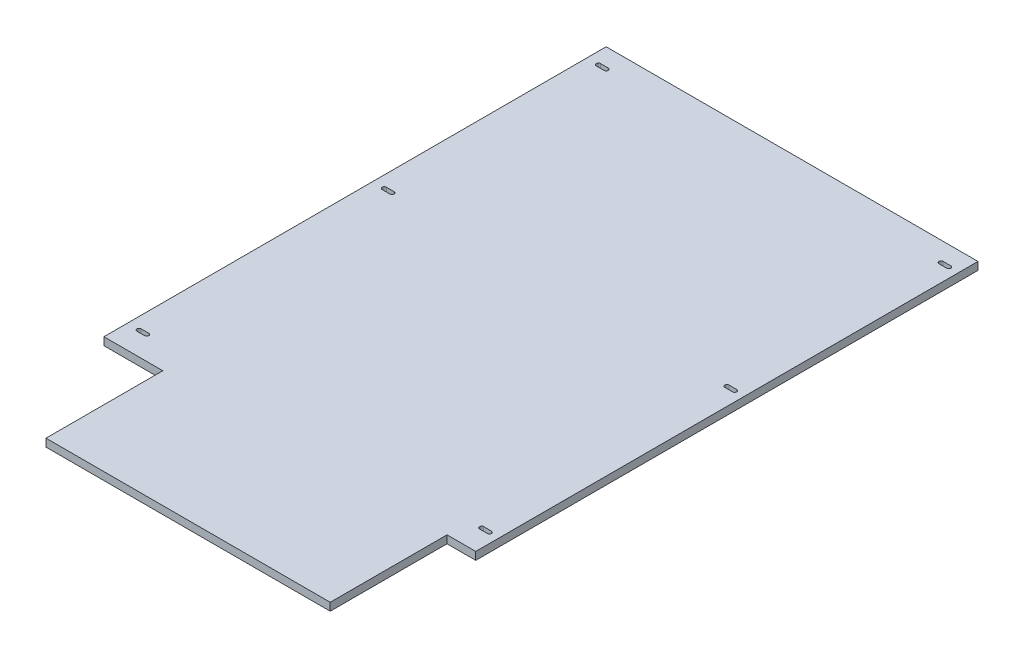
from build123d import *

# Parameters (mm, degrees)
BOSS_EXTRUDE1_DEPTH = 12.7


with BuildPart() as part:
    # Sketch1 → Boss-Extrude1 (new body)
    with BuildSketch(Plane(origin=(0, 0, 0), x_dir=(1, 0, 0), z_dir=(0, 1, 0))):
        Polygon((0, 0), (96.04375, 0), (96.04375, -190.5), (559.59375, -190.5), (559.59375, 0), (606.425, 0), (606.425, 819.15), (0, 819.15), align=None)
        with BuildLine():
            Line((19.05, 41.4782), (31.75, 41.4782))
            ThreePointArc((31.75, 41.4782), (35.1282, 38.1), (31.75, 34.7218))
            Line((31.75, 34.7218), (19.05, 34.7218))
            ThreePointArc((19.05, 34.7218), (15.6718, 38.1), (19.05, 41.4782))
        make_face(mode=Mode.SUBTRACT)
        with BuildLine():
            Line((19.05, 441.5282), (31.75, 441.5282))
            ThreePointArc((31.75, 441.5282), (35.1282, 438.15), (31.75, 434.7718))
            Line((31.75, 434.7718), (19.05, 434.7718))
            ThreePointArc((19.05, 434.7718), (15.6718, 438.15), (19.05, 441.5282))
        make_face(mode=Mode.SUBTRACT)
        with BuildLine():
            Line((31.75, 784.0218), (19.05, 784.0218))
            ThreePointArc((19.05, 784.0218), (15.6718, 787.4), (19.05, 790.7782))
            Line((19.05, 790.7782), (31.75, 790.7782))
            ThreePointArc((31.75, 790.7782), (35.1282, 787.4), (31.75, 784.0218))
        make_face(mode=Mode.SUBTRACT)
        with BuildLine():
            Line((577.85, 784.0218), (590.55, 784.0218))
            ThreePointArc((590.55, 784.0218), (593.9282, 787.4), (590.55, 790.7782))
            Line((590.55, 790.7782), (577.85, 790.7782))
            ThreePointArc((577.85, 790.7782), (574.4718, 787.4), (577.85, 784.0218))
        make_face(mode=Mode.SUBTRACT)
        with BuildLine():
            Line((590.55, 441.5282), (577.85, 441.5282))
            ThreePointArc((577.85, 441.5282), (574.4718, 438.15), (577.85, 434.7718))
            Line((577.85, 434.7718), (590.55, 434.7718))
            ThreePointArc((590.55, 434.7718), (593.9282, 438.15), (590.55, 441.5282))
        make_face(mode=Mode.SUBTRACT)
        with BuildLine():
            Line((590.55, 41.4782), (577.85, 41.4782))
            ThreePointArc((577.85, 41.4782), (574.4718, 38.1), (577.85, 34.7218))
            Line((577.85, 34.7218), (590.55, 34.7218))
            ThreePointArc((590.55, 34.7218), (593.9282, 38.1), (590.55, 41.4782))
        make_face(mode=Mode.SUBTRACT)
    extrude(amount=BOSS_EXTRUDE1_DEPTH)


solid = part.part
